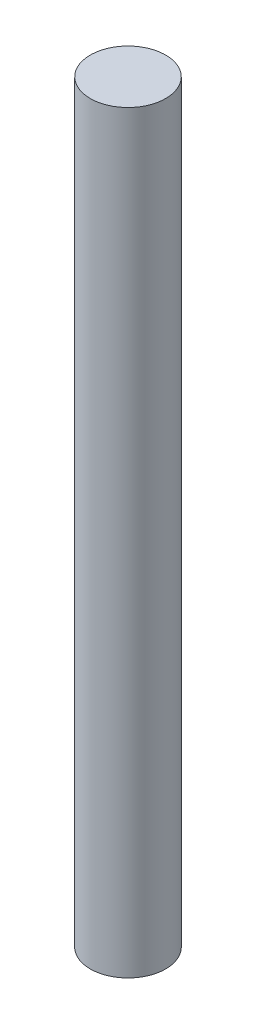
from build123d import *

# Parameters (mm, degrees)
SKETCH1_R           = 10
BOSS_EXTRUDE1_DEPTH = 200


with BuildPart() as part:
    # Sketch1 → Boss-Extrude1 (new body)
    with BuildSketch(Plane(origin=(0, 0, 0), x_dir=(1, 0, 0), z_dir=(0, 1, 0))):
        with Locations(Location((0, 0, 0), (0, 0, 270))):
            Circle(SKETCH1_R)
    extrude(amount=BOSS_EXTRUDE1_DEPTH)


solid = part.part
